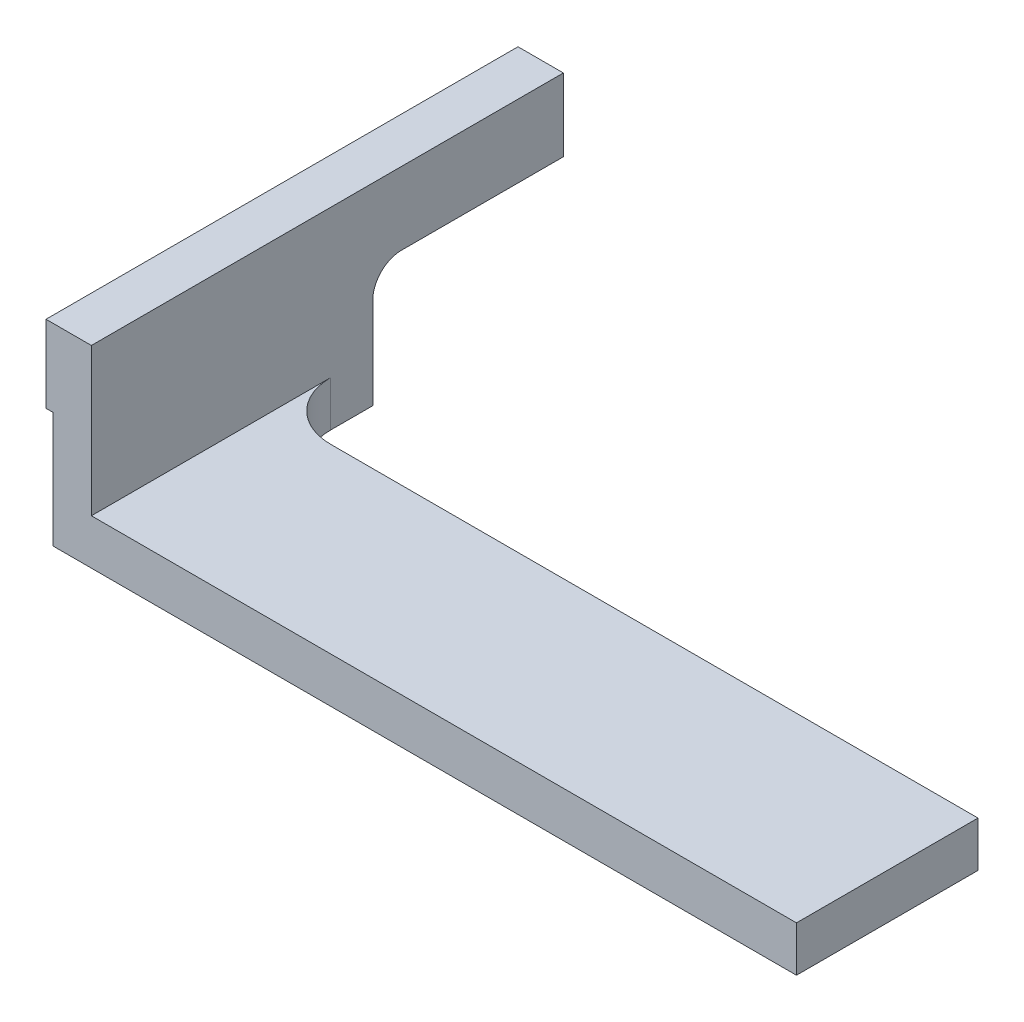
from build123d import *

# Parameters (mm, degrees)
EXTRUDE1_DEPTH     = 26
SKETCH24_W         = 77.68
SKETCH24_H         = 32
CUT_EXTRUDE1_DEPTH = 89.181885328
FILLET1_R          = 6.35
SKETCH25_W         = 0.75
SKETCH25_H         = 12.75
CUT_EXTRUDE2_DEPTH = 100.95771556
CUT_EXTRUDE5_DEPTH = 85.627093179


with BuildPart() as part:
    # Sketch1 → Extrude1 (new, symmetric)
    with BuildSketch(Plane.XY):
        Polygon((0, 0), (0, 21.25), (5, 21.25), (5, 5), (82.68, 5), (82.68, 0), align=None)
    extrude(amount=EXTRUDE1_DEPTH, both=True)

    # Sketch24 → Cut-Extrude1 (cut, through all)
    with BuildSketch(Plane(origin=(0, 5, 0), x_dir=(1, 0, 0), z_dir=(0, 1, 0))):
        with Locations((43.84, 10)):
            Rectangle(SKETCH24_W, SKETCH24_H)
    extrude(amount=-CUT_EXTRUDE1_DEPTH, mode=Mode.SUBTRACT)

    # Fillet1
    fillet1_edges = [part.edges().sort_by_distance(p)[0] for p in [
        (5, 2.5, 6),
    ]]
    fillet(fillet1_edges, radius=FILLET1_R)

    # Sketch25 → Cut-Extrude2 (cut, through all)
    with BuildSketch(Plane.XY.offset(26)):
        with Locations((0.375, 6.375)):
            Rectangle(SKETCH25_W, SKETCH25_H)
    extrude(amount=-CUT_EXTRUDE2_DEPTH, mode=Mode.SUBTRACT)

    # Sketch30 → Cut-Extrude5 (cut, through all)
    with BuildSketch(Plane(origin=(5, 0, 0), x_dir=(0, 0, -1), z_dir=(1, 0, 0))):
        with BuildLine():
            Line((26, 0), (5, 0))
            Line((5, 0), (5, 10.075))
            ThreePointArc((5, 10.075), (5.92993597, 12.32006403), (8.175, 13.25))
            Line((8.175, 13.25), (26, 13.25))
            Line((26, 13.25), (26, 0))
        make_face()
    extrude(amount=-CUT_EXTRUDE5_DEPTH, mode=Mode.SUBTRACT)


solid = part.part
